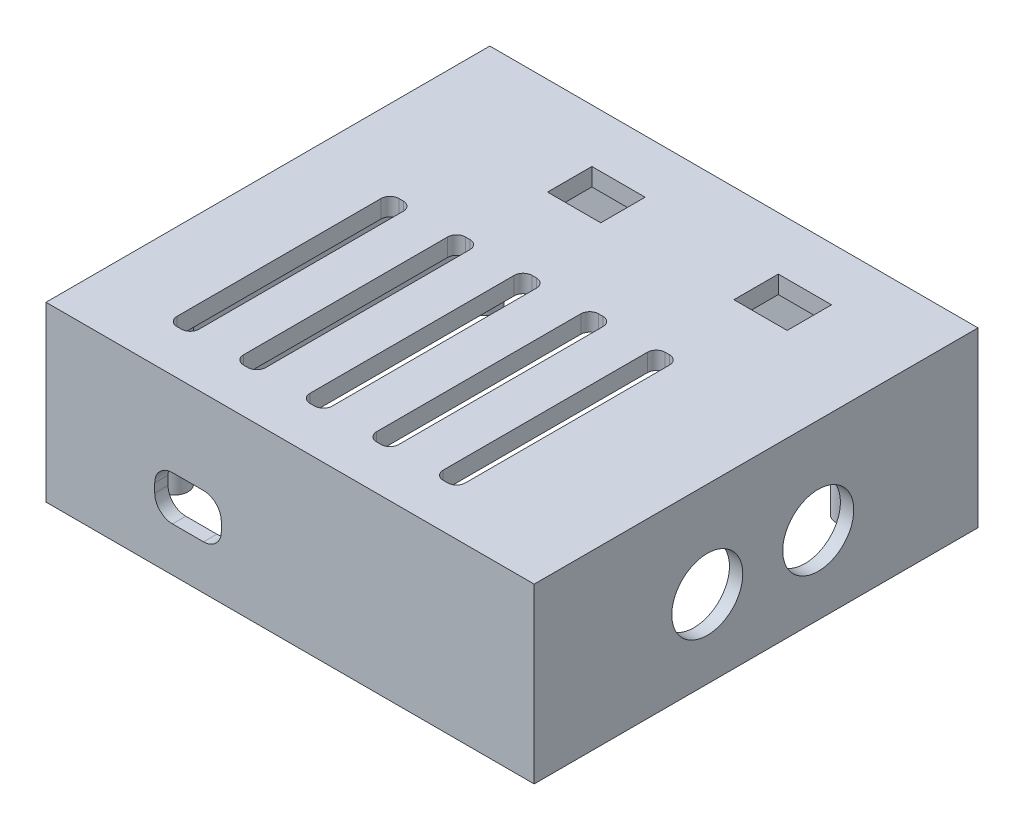
from build123d import *

# Parameters (mm, degrees)
BOSS_EXTRUDE1_DEPTH      = 1
BOSS_EXTRUDE1_DEPTH_BACK = 3
SKETCH1_W                = 110
SKETCH1_H                = 100
SKETCH2_W                = 110
SKETCH2_H                = 100
SKETCH2_W_2              = 104
SKETCH2_H_2              = 94
BOSS_EXTRUDE2_DEPTH      = 35
SKETCH3_R                = 3
SKETCH3_R_2              = 1.3
BOSS_EXTRUDE3_DEPTH      = 32
SKETCH5_W                = 12
SKETCH5_H                = 20
CUT_EXTRUDE5_DEPTH       = 32
SKETCH6_W                = 15
SKETCH6_H                = 10
CUT_EXTRUDE6_DEPTH       = 32
SKETCH7_R                = 8
CUT_EXTRUDE7_DEPTH       = 22
SKETCH8_W                = 12
SKETCH8_H                = 10
CUT_EXTRUDE8_DEPTH       = 22
SKETCH9_W                = 5
SKETCH9_H                = 50
CUT_EXTRUDE9_DEPTH       = 10
FILLET1_R                = 2
FILLET2_R                = 3
FILLET3_R                = 4


with BuildPart() as part:
    # Sketch1 → Boss-Extrude1 (new, two sides: drawn at the far end of the back side and taken through both)
    with BuildSketch(Plane(origin=(0, 0, 0), x_dir=(1, 0, 0), z_dir=(0, 1, 0)).offset(-BOSS_EXTRUDE1_DEPTH_BACK)):
        Rectangle(SKETCH1_W, SKETCH1_H)
    extrude(amount=BOSS_EXTRUDE1_DEPTH + BOSS_EXTRUDE1_DEPTH_BACK)

    # Sketch2 → Boss-Extrude2 (add)
    with BuildSketch(Plane.XZ.offset(3)):
        Rectangle(SKETCH2_W, SKETCH2_H)
        Rectangle(SKETCH2_W_2, SKETCH2_H_2, mode=Mode.SUBTRACT)
    extrude(amount=BOSS_EXTRUDE2_DEPTH)

    # Sketch3 → Boss-Extrude3 (add)
    # profile 1 of 4: a face of its own
    with BuildSketch(Plane.XZ.offset(3)):
        with Locations(Location((-41, 35, 0), (0, 0, 90))):
            Circle(SKETCH3_R)
        with Locations(Location((-41, 35, 0), (0, 0, 270))):
            Circle(SKETCH3_R_2, mode=Mode.SUBTRACT)
    # profile 2 of 4: a face of its own
    with BuildSketch(Plane.XZ.offset(3)):
        with Locations(Location((-41, -35, 0), (0, 0, 90))):
            Circle(SKETCH3_R)
        with Locations(Location((-41, -35, 0), (0, 0, 90))):
            Circle(SKETCH3_R_2, mode=Mode.SUBTRACT)
    # profile 3 of 4: a face of its own
    with BuildSketch(Plane.XZ.offset(3)):
        with Locations(Location((41, -35, 0), (0, 0, 90))):
            Circle(SKETCH3_R)
        with Locations(Location((41, -35, 0), (0, 0, 270))):
            Circle(SKETCH3_R_2, mode=Mode.SUBTRACT)
    # profile 4 of 4: a face of its own
    with BuildSketch(Plane.XZ.offset(3)):
        with Locations(Location((41, 35, 0), (0, 0, 90))):
            Circle(SKETCH3_R)
        with Locations(Location((41, 35, 0), (0, 0, 90))):
            Circle(SKETCH3_R_2, mode=Mode.SUBTRACT)
    extrude(amount=BOSS_EXTRUDE3_DEPTH)

    # Sketch5 → Cut-Extrude5 (cut)
    with BuildSketch(Plane(origin=(0, 0, -50), x_dir=(-1, 0, 0), z_dir=(0, 0, -1))):
        with Locations((-28, -28)):
            Rectangle(SKETCH5_W, SKETCH5_H)
        with Locations((14, -28)):
            Rectangle(SKETCH5_W, SKETCH5_H)
    extrude(amount=-CUT_EXTRUDE5_DEPTH, mode=Mode.SUBTRACT)

    # Sketch6 → Cut-Extrude6 (cut)
    with BuildSketch(Plane.XY.offset(50)):
        with Locations((-23, -23)):
            Rectangle(SKETCH6_W, SKETCH6_H)
    extrude(amount=-CUT_EXTRUDE6_DEPTH, mode=Mode.SUBTRACT)

    # Sketch7 → Cut-Extrude7 (cut)
    with BuildSketch(Plane(origin=(55, 0, 0), x_dir=(0, 0, -1), z_dir=(1, 0, 0))):
        with Locations((-11, -20.5)):
            Circle(SKETCH7_R)
        with Locations((14, -20.5)):
            Circle(SKETCH7_R)
    extrude(amount=-CUT_EXTRUDE7_DEPTH, mode=Mode.SUBTRACT)

    # Sketch8 → Cut-Extrude8 (cut)
    with BuildSketch(Plane(origin=(0, 1, 0), x_dir=(1, 0, 0), z_dir=(0, 1, 0))):
        with Locations((28, 33)):
            Rectangle(SKETCH8_W, SKETCH8_H)
        with Locations((-14, 33)):
            Rectangle(SKETCH8_W, SKETCH8_H)
    extrude(amount=-CUT_EXTRUDE8_DEPTH, mode=Mode.SUBTRACT)

    # Sketch9 → Cut-Extrude9 (cut)
    with BuildSketch(Plane(origin=(0, 1, 0), x_dir=(1, 0, 0), z_dir=(0, 1, 0))):
        with Locations((-35, -15)):
            Rectangle(SKETCH9_W, SKETCH9_H)
        with Locations((-20, -15)):
            Rectangle(SKETCH9_W, SKETCH9_H)
        with Locations((-5, -15)):
            Rectangle(SKETCH9_W, SKETCH9_H)
        with Locations((10, -15)):
            Rectangle(SKETCH9_W, SKETCH9_H)
        with Locations((25, -15)):
            Rectangle(SKETCH9_W, SKETCH9_H)
    extrude(amount=-CUT_EXTRUDE9_DEPTH, mode=Mode.SUBTRACT)

    # Fillet1
    fillet1_edges = [part.edges().sort_by_distance(p)[0] for p in [
        (-32.5, -1, -10),
        (-32.5, -1, 40),
        (-37.5, -1, 40),
        (-37.5, -1, -10),
        (-17.5, -1, -10),
        (-17.5, -1, 40),
        (-22.5, -1, 40),
        (-22.5, -1, -10),
        (-2.5, -1, -10),
        (-2.5, -1, 40),
        (-7.5, -1, 40),
        (-7.5, -1, -10),
        (7.5, -1, 40),
        (7.5, -1, -10),
        (12.5, -1, -10),
        (12.5, -1, 40),
        (22.5, -1, 40),
        (22.5, -1, -10),
        (27.5, -1, -10),
        (27.5, -1, 40),
    ]]
    fillet(fillet1_edges, radius=FILLET1_R)

    # Fillet2
    fillet2_edges = [part.edges().sort_by_distance(p)[0] for p in [
        (-20, -18, -48.5),
        (-8, -18, -48.5),
        (34, -18, -48.5),
        (22, -18, -48.5),
    ]]
    fillet(fillet2_edges, radius=FILLET2_R)

    # Fillet3
    fillet3_edges = [part.edges().sort_by_distance(p)[0] for p in [
        (-15.5, -18, 48.5),
        (-15.5, -28, 48.5),
        (-30.5, -28, 48.5),
        (-30.5, -18, 48.5),
    ]]
    fillet(fillet3_edges, radius=FILLET3_R)


solid = part.part
